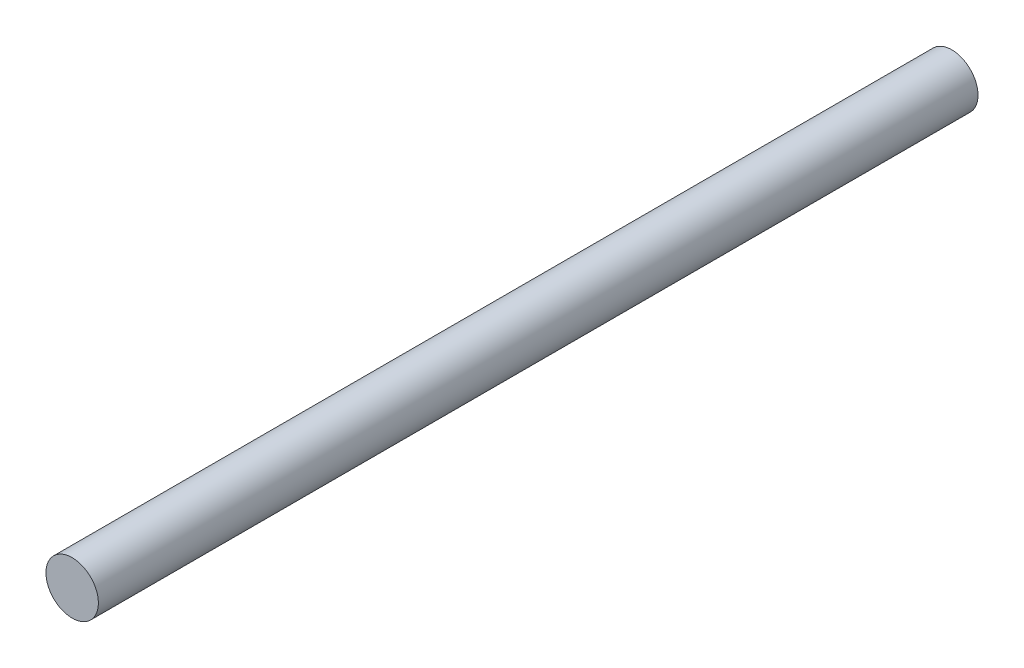
from build123d import *

# Parameters (mm, degrees)
SKETCH1_R           = 2
BOSS_EXTRUDE1_DEPTH = 33.55


with BuildPart() as part:
    # Sketch1 → Boss-Extrude1 (new, symmetric)
    with BuildSketch(Plane.XY):
        Circle(SKETCH1_R)
    extrude(amount=BOSS_EXTRUDE1_DEPTH, both=True)


solid = part.part
